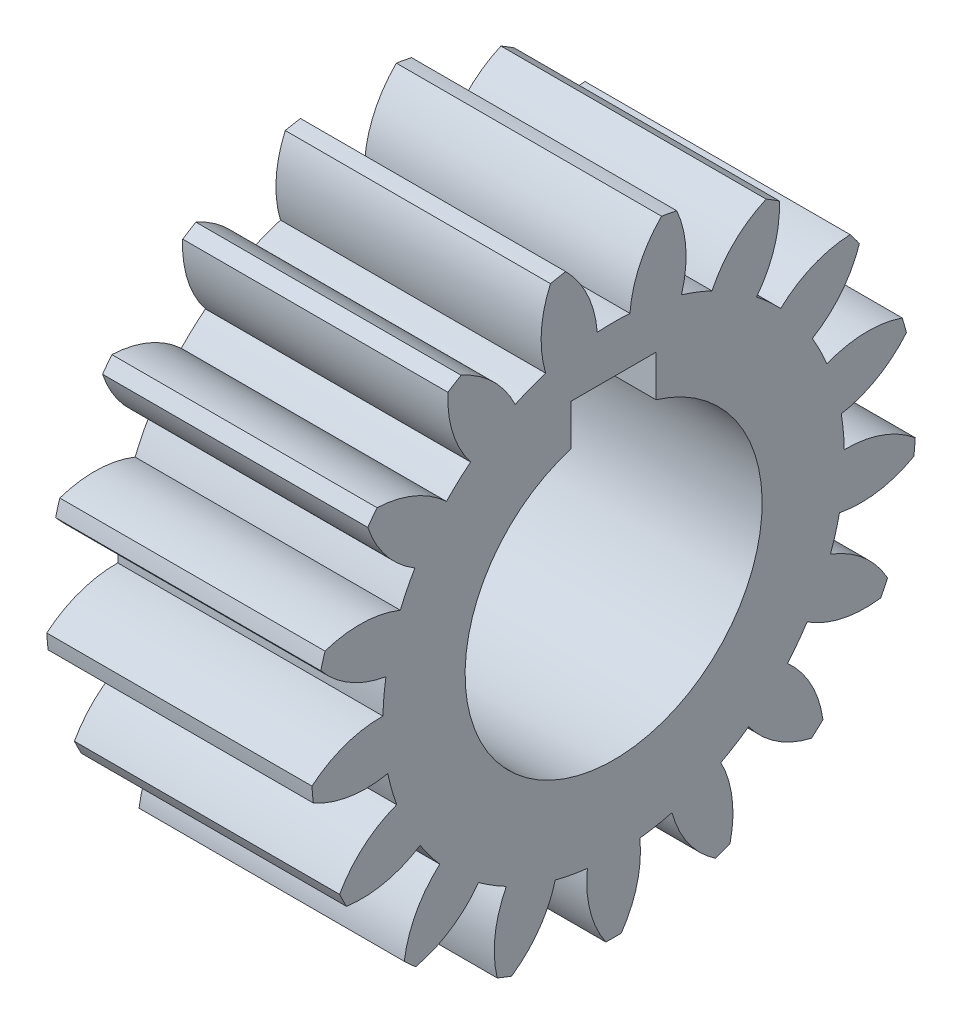
from build123d import *

# Parameters (mm, degrees)
BASPROSKE_W     = 25
BASPROSKE_H     = 28.5
TOOTHCUT_DEPTH  = 48.428894147
TEETHCUTS_COUNT = 17
TEETHCUTS_ANGLE = 338.823529412
BORSKE_R        = 14
BORE_DEPTH      = 50.0000508
KEYSKE_W        = 8
KEYSKE_H        = 17.3
KEYWAY_DEPTH    = 50.0000508


with BuildPart() as part:
    # BasProSke → Base-Revolve (revolve)
    with BuildSketch(Plane(origin=(0, 0, 0), x_dir=(1, 0, 0), z_dir=(0, 1, 0)), mode=Mode.PRIVATE) as base_revolve_sk:
        with Locations((12.5, 14.25)):
            Rectangle(BASPROSKE_W, BASPROSKE_H)
    revolve(base_revolve_sk.sketch.rotate(Axis((-10, 0, 0), (1, 0, 0)), 180), axis=Axis((-10, 0, 0), (1, 0, 0)))

    # TooCutSke → ToothCut (cut, through all)
    with BuildSketch(Plane(origin=(0, 0, 0), x_dir=(0, 0, -1), z_dir=(1, 0, 0))):
        with BuildLine():
            ThreePointArc((1.540279816, 21.694389576), (0, 21.749), (-1.540279816, 21.694389576))
            ThreePointArc((-1.540279816, 21.694389576), (-2.457007956, 25.198716871), (-4.540621854, 28.161697363))
            ThreePointArc((-4.540621854, 28.161697363), (0, 28.5254), (4.540621854, 28.161697363))
            ThreePointArc((4.540621854, 28.161697363), (2.457007956, 25.198716871), (1.540279816, 21.694389576))
        make_face()
    toothcut = extrude(amount=TOOTHCUT_DEPTH, mode=Mode.SUBTRACT)

    # TeethCuts: ToothCut ×17 about axis
    teethcuts_axis = Axis((-10, 0, 0), (1, 0, 0))
    for i in range(1, TEETHCUTS_COUNT):
        add(toothcut.rotate(teethcuts_axis, i * TEETHCUTS_ANGLE / (TEETHCUTS_COUNT - 1)), mode=Mode.SUBTRACT)

    # BorSke → Bore (cut, symmetric)
    with BuildSketch(Plane(origin=(0, 0, 0), x_dir=(0, 0, -1), z_dir=(1, 0, 0))):
        with Locations(Location((0, 0, 0), (0, 0, 180))):
            Circle(BORSKE_R)
    extrude(amount=BORE_DEPTH, both=True, mode=Mode.SUBTRACT)

    # KeySke → Keyway (cut, symmetric)
    with BuildSketch(Plane(origin=(0, 0, 0), x_dir=(0, 0, -1), z_dir=(1, 0, 0))):
        with Locations((0, 8.65)):
            Rectangle(KEYSKE_W, KEYSKE_H)
    extrude(amount=KEYWAY_DEPTH, both=True, mode=Mode.SUBTRACT)


solid = part.part
